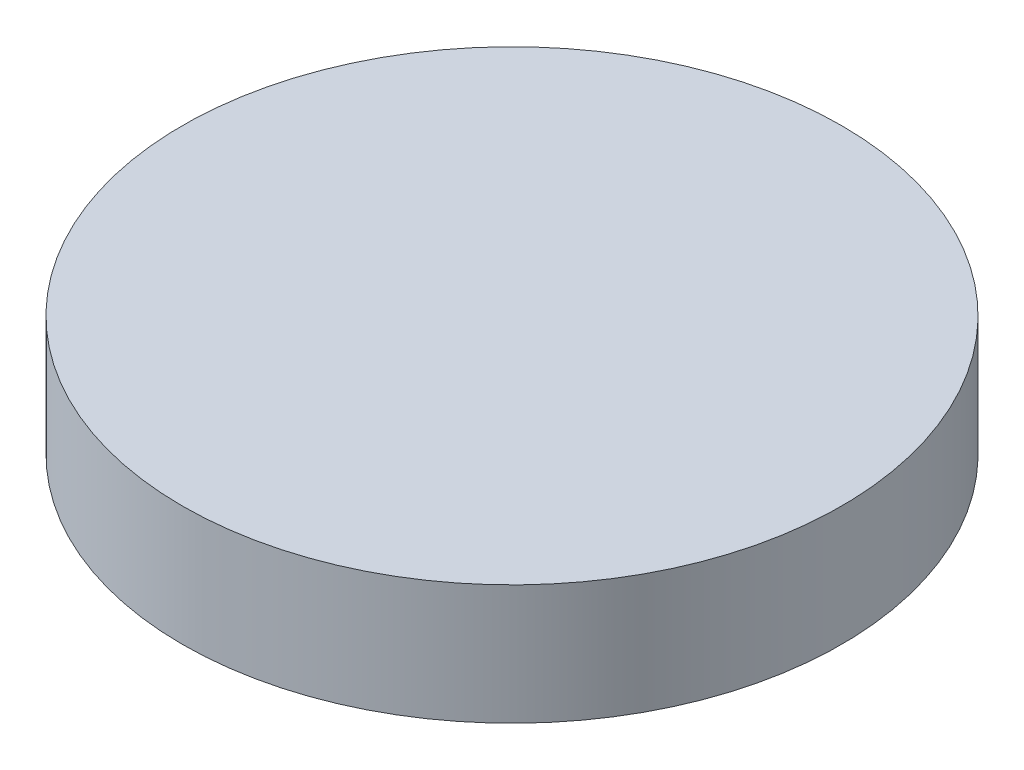
from build123d import *

# Parameters (mm, degrees)
SKETCH_1_R      = 27.5
EXTRUDE_1_DEPTH = 10


with BuildPart() as part:
    # 草图1 → 凸台-拉伸1 (new body)
    with BuildSketch(Plane(origin=(0, 0, 0), x_dir=(1, 0, 0), z_dir=(0, 1, 0))):
        with Locations(Location((0, 0, 0), (0, 0, 270))):
            Circle(SKETCH_1_R)
    extrude(amount=EXTRUDE_1_DEPTH)


solid = part.part
